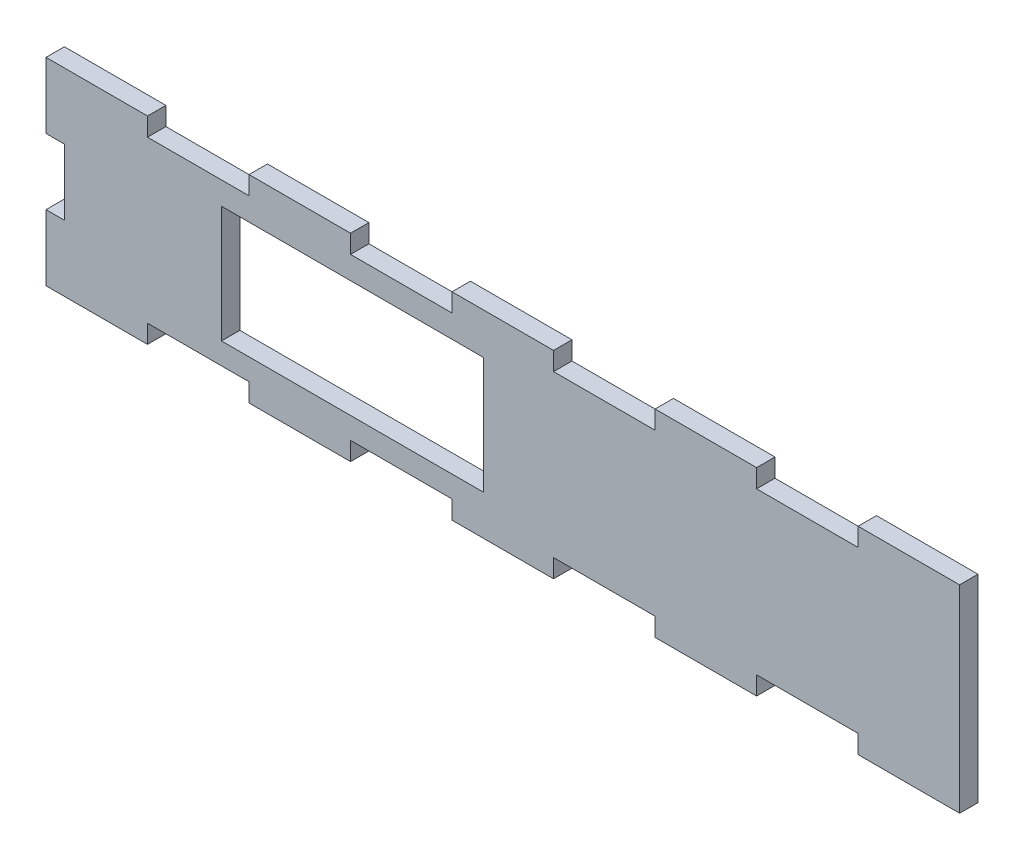
from build123d import *

# Parameters (mm, degrees)
SKETCH2_W           = 228.6
SKETCH2_H           = 49.499999806
BOSS_EXTRUDE1_DEPTH = 4.599999944
SKETCH4_W           = 25.4
SKETCH4_H           = 4.599999944
CUT_EXTRUDE1_DEPTH  = 234.943091328
SKETCH5_W           = 4.599999944
SKETCH5_H           = 16.499999936
CUT_EXTRUDE2_DEPTH  = 4.599999944
SKETCH6_W           = 65.500000064
SKETCH6_H           = 29.20000002
CUT_EXTRUDE3_DEPTH  = 270.181953409


with BuildPart() as part:
    # Sketch2 → Boss-Extrude1 (new body)
    with BuildSketch(Plane.XY):
        with Locations((114.3, 24.749999903)):
            Rectangle(SKETCH2_W, SKETCH2_H)
    extrude(amount=BOSS_EXTRUDE1_DEPTH)

    # Sketch4 → Cut-Extrude1 (cut, through all)
    with BuildSketch(Plane.XY.offset(4.599999944)):
        with Locations((38.1, 2.299999972)):
            Rectangle(SKETCH4_W, SKETCH4_H)
        with Locations((88.9, 2.299999972)):
            Rectangle(SKETCH4_W, SKETCH4_H)
        with Locations((139.7, 2.299999972)):
            Rectangle(SKETCH4_W, SKETCH4_H)
        with Locations((190.5, 2.299999972)):
            Rectangle(SKETCH4_W, SKETCH4_H)
    cut_extrude1 = extrude(amount=-CUT_EXTRUDE1_DEPTH, mode=Mode.SUBTRACT)

    # Mirror1: Cut-Extrude1 across plane
    add(cut_extrude1.mirror(Plane.ZX.offset(24.749999903)), mode=Mode.SUBTRACT)

    # Sketch5 → Cut-Extrude2 (cut)
    with BuildSketch(Plane.ZY):
        with Locations((2.299999972, 24.749999903)):
            Rectangle(SKETCH5_W, SKETCH5_H)
    extrude(amount=-CUT_EXTRUDE2_DEPTH, mode=Mode.SUBTRACT)

    # Sketch6 → Cut-Extrude3 (cut, through all)
    with BuildSketch(Plane(origin=(29.45757895, -124.715298599, 49.499999806), x_dir=(1, 0, 0), z_dir=(0, 0, 1))):
        with Locations((47.200087569, 149.315298548)):
            Rectangle(SKETCH6_W, SKETCH6_H)
    extrude(amount=-CUT_EXTRUDE3_DEPTH, mode=Mode.SUBTRACT)


solid = part.part
